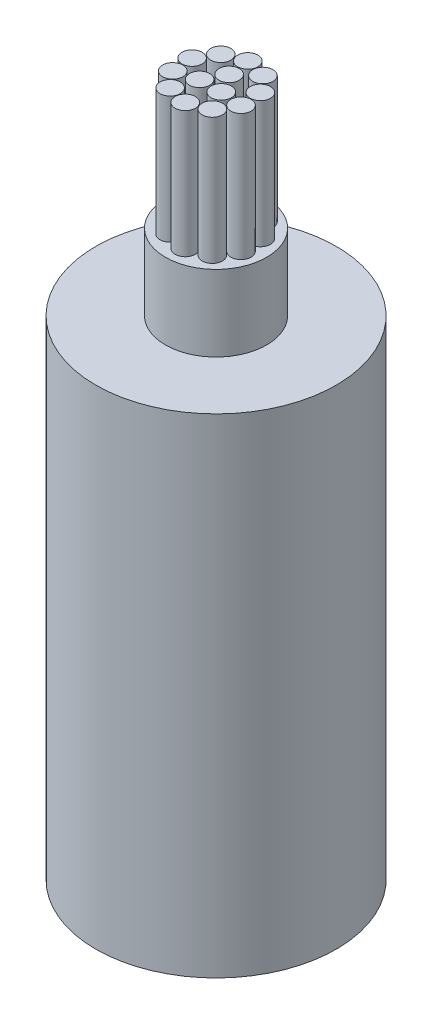
from build123d import *

# Parameters (mm, degrees)
SKETCH1_R           = 6.2
BOSS_EXTRUDE1_DEPTH = 19.5
SKETCH2_R           = 2
BOSS_EXTRUDE2_DEPTH = 2.8
SKETCH3_R           = 0.4
BOSS_EXTRUDE4_DEPTH = 5
CUT_EXTRUDE1_START  = -0.2
SKETCH4_R           = 4.75
SKETCH4_R_2         = 2
CUT_EXTRUDE1_DEPTH  = 0.2
SKETCH5_R           = 0.4
BOSS_EXTRUDE5_DEPTH = 3.5
SKETCH6_R           = 6.2
SKETCH6_R_2         = 4.75
CUT_EXTRUDE2_DEPTH  = 25.614629796
SKETCH7_R           = 9.512731099
CUT_EXTRUDE3_DEPTH  = 29.114320195


with BuildPart() as part:
    # Sketch1 → Boss-Extrude1 (new body)
    with BuildSketch(Plane(origin=(0, 0, 0), x_dir=(1, 0, 0), z_dir=(0, 1, 0))):
        with Locations(Location((0, 0, 0), (0, 0, 270))):
            Circle(SKETCH1_R)
    extrude(amount=BOSS_EXTRUDE1_DEPTH)

    # Sketch2 → Boss-Extrude2 (add)
    with BuildSketch(Plane(origin=(0, 19.5, 0), x_dir=(1, 0, 0), z_dir=(0, 1, 0))):
        with Locations(Location((0, 0, 0), (0, 0, 270))):
            Circle(SKETCH2_R)
    extrude(amount=BOSS_EXTRUDE2_DEPTH)

    # Sketch3 → Boss-Extrude4 (add)
    with BuildSketch(Plane(origin=(0, 22.3, 0), x_dir=(1, 0, 0), z_dir=(0, 1, 0))):
        with Locations(Location((-0.41145274, -0.237271907, 0), (0, 0, 270))):
            Circle(SKETCH3_R)
        with Locations(Location((-0.09128588, 1.346231062, 0), (0, 0, 270))):
            Circle(SKETCH3_R)
        with Locations(Location((0.706061251, 1.146478436, 0), (0, 0, 270))):
            Circle(SKETCH3_R)
        with Locations(Location((1.233716983, 0.516206281, 0), (0, 0, 270))):
            Circle(SKETCH3_R)
        with Locations(Location((1.29013476, -0.30384286, 0), (0, 0, 270))):
            Circle(SKETCH3_R)
        with Locations(Location((0.853764908, -1.000438089, 0), (0, 0, 270))):
            Circle(SKETCH3_R)
        with Locations(Location((0.09128588, -1.307503705, 0), (0, 0, 270))):
            Circle(SKETCH3_R)
        with Locations(Location((-0.706061251, -1.107751078, 0), (0, 0, 270))):
            Circle(SKETCH3_R)
        with Locations(Location((-1.233716983, -0.477478923, 0), (0, 0, 270))):
            Circle(SKETCH3_R)
        with Locations(Location((-1.29013476, 0.342570218, 0), (0, 0, 270))):
            Circle(SKETCH3_R)
        with Locations(Location((-0.853764908, 1.039165447, 0), (0, 0, 270))):
            Circle(SKETCH3_R)
        with Locations(Location((0, 0.516206281, 0), (0, 0, 270))):
            Circle(SKETCH3_R)
        with Locations(Location((0.441742202, -0.237271907, 0), (0, 0, 270))):
            Circle(SKETCH3_R)
    extrude(amount=BOSS_EXTRUDE4_DEPTH)

    # Sketch4 → Cut-Extrude1 (cut)
    with BuildSketch(Plane(origin=(0, 19.5, 0), x_dir=(1, 0, 0), z_dir=(0, 1, 0)).offset(CUT_EXTRUDE1_START)):
        with Locations(Location((0, 0, 0), (0, 0, 270))):
            Circle(SKETCH4_R)
        with Locations(Location((0, 0, 0), (0, 0, 270))):
            Circle(SKETCH4_R_2, mode=Mode.SUBTRACT)
    extrude(amount=CUT_EXTRUDE1_DEPTH, mode=Mode.SUBTRACT)

    # Sketch5 → Boss-Extrude5 (add)
    with BuildSketch(Plane.XZ):
        with Locations(Location((-5.700120356, 0, 0), (0, 0, 90))):
            Circle(SKETCH5_R)
        with Locations(Location((-5.629942415, 0.891695278, 0), (0, 0, 90))):
            Circle(SKETCH5_R)
        with Locations(Location((-4.791405516, 0, 0), (0, 0, 90))):
            Circle(SKETCH5_R)
        with Locations(Location((-4.703373902, 0.914243273, 0), (0, 0, 90))):
            Circle(SKETCH5_R)
        with Locations(Location((-4.703373902, -0.914243273, 0), (0, 0, 90))):
            Circle(SKETCH5_R)
        with Locations(Location((-5.629942415, -0.891695278, 0), (0, 0, 90))):
            Circle(SKETCH5_R)
        with Locations(Location((5.629942415, -0.891695278, 0), (0, 0, 90))):
            Circle(SKETCH5_R)
        with Locations(Location((4.703373902, -0.914243273, 0), (0, 0, 90))):
            Circle(SKETCH5_R)
        with Locations(Location((4.703373902, 0.914243273, 0), (0, 0, 90))):
            Circle(SKETCH5_R)
        with Locations(Location((4.791405516, 0, 0), (0, 0, 90))):
            Circle(SKETCH5_R)
        with Locations(Location((5.629942415, 0.891695278, 0), (0, 0, 90))):
            Circle(SKETCH5_R)
        with Locations(Location((5.700120356, 0, 0), (0, 0, 90))):
            Circle(SKETCH5_R)
    extrude(amount=BOSS_EXTRUDE5_DEPTH)

    # Sketch6 → Cut-Extrude2 (cut, through all)
    with BuildSketch(Plane(origin=(0, 19.5, 0), x_dir=(1, 0, 0), z_dir=(0, 1, 0))):
        Circle(SKETCH6_R)
        with Locations(Location((0, 0, 0), (0, 0, 270))):
            Circle(SKETCH6_R_2, mode=Mode.SUBTRACT)
    extrude(amount=-CUT_EXTRUDE2_DEPTH, mode=Mode.SUBTRACT)

    # Sketch7 → Cut-Extrude3 (cut, through all)
    with BuildSketch(Plane.XZ):
        Circle(SKETCH7_R)
    extrude(amount=CUT_EXTRUDE3_DEPTH, mode=Mode.SUBTRACT)


solid = part.part
